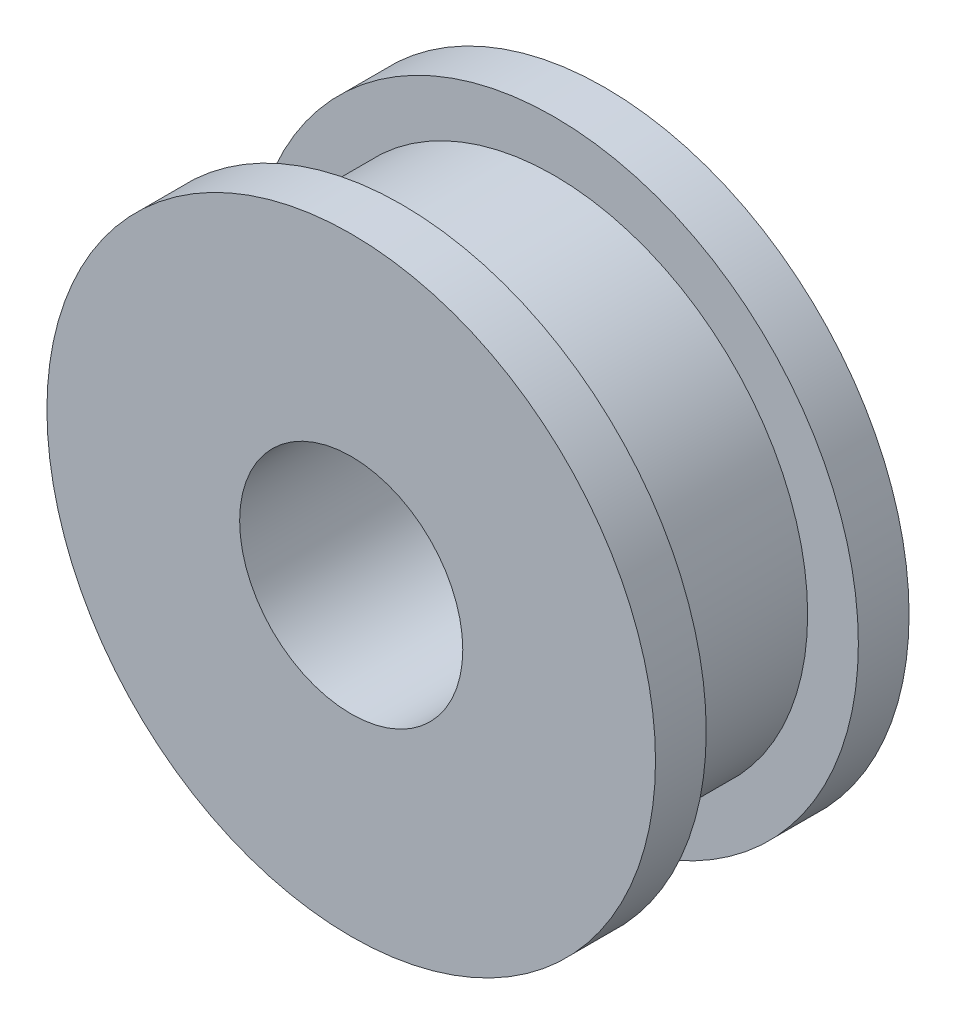
from build123d import *

# Parameters (mm, degrees)
IZIM1_R                     = 25
Y_KSEKLIK_EKSTR_ZYON1_DEPTH = 15
IZIM3_R                     = 30
Y_KSEKLIK_EKSTR_ZYON2_DEPTH = 5
Y_KSEKLIK_EKSTR_ZYON3_START = 5
IZIM4_R                     = 30
Y_KSEKLIK_EKSTR_ZYON3_DEPTH = 5
IZIM5_R                     = 11
KES_EKSTR_ZYON1_DEPTH       = 50.244289009


with BuildPart() as part:
    # Çizim1 → Yükseklik-Ekstrüzyon1 (new body)
    with BuildSketch(Plane.XY):
        Circle(IZIM1_R)
    extrude(amount=Y_KSEKLIK_EKSTR_ZYON1_DEPTH)

    # Çizim3 → Yükseklik-Ekstrüzyon2 (add)
    with BuildSketch(Plane(origin=(0, 0, 0), x_dir=(-1, 0, 0), z_dir=(0, 0, -1))):
        Circle(IZIM3_R)
    extrude(amount=Y_KSEKLIK_EKSTR_ZYON2_DEPTH)

    # Çizim4 → Yükseklik-Ekstrüzyon3 (add)
    with BuildSketch(Plane.XY.offset(15).offset(Y_KSEKLIK_EKSTR_ZYON3_START)):
        with Locations(Location((0, 0, 0), (0, 0, 180))):
            Circle(IZIM4_R)
    extrude(amount=-Y_KSEKLIK_EKSTR_ZYON3_DEPTH)

    # Çizim5 → Kes-Ekstrüzyon1 (cut, through all)
    with BuildSketch(Plane.XY.offset(20)):
        Circle(IZIM5_R)
    extrude(amount=-KES_EKSTR_ZYON1_DEPTH, mode=Mode.SUBTRACT)


solid = part.part
